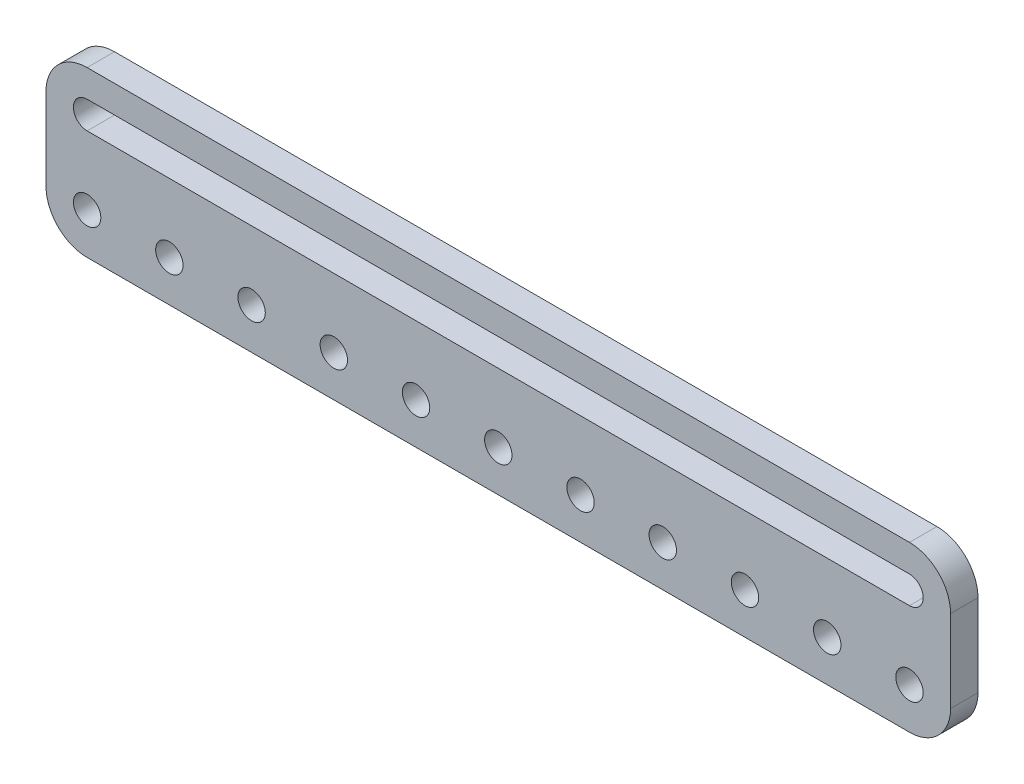
from build123d import *

# Parameters (mm, degrees)
MODEL_R                 = 1.5
SALIENTE_EXTRUIR1_DEPTH = 3


with BuildPart() as part:
    # Model → Saliente-Extruir1 (new body)
    with BuildSketch(Plane.XY):
        with BuildLine():
            Line((256.429131311, 228.742243614), (346.429131311, 228.742243614))
            ThreePointArc((346.429131311, 228.742243614), (349.611111826, 227.424224129), (350.929131311, 224.242243614))
            Line((350.929131311, 224.242243614), (350.929131311, 215.242243614))
            ThreePointArc((350.929131311, 215.242243614), (349.611111826, 212.060263099), (346.429131311, 210.742243614))
            Line((346.429131311, 210.742243614), (256.429131311, 210.742243614))
            ThreePointArc((256.429131311, 210.742243614), (253.247150795, 212.060263099), (251.929131311, 215.242243614))
            Line((251.929131311, 215.242243614), (251.929131311, 224.242243614))
            ThreePointArc((251.929131311, 224.242243614), (253.247150795, 227.424224129), (256.429131311, 228.742243614))
        make_face()
        with Locations((337.429131311, 215.242243614)):
            Circle(MODEL_R, mode=Mode.SUBTRACT)
        with Locations((319.429131311, 215.242243614)):
            Circle(MODEL_R, mode=Mode.SUBTRACT)
        with Locations((328.429131311, 215.242243614)):
            Circle(MODEL_R, mode=Mode.SUBTRACT)
        with Locations((310.429131311, 215.242243614)):
            Circle(MODEL_R, mode=Mode.SUBTRACT)
        with Locations((292.429131311, 215.242243614)):
            Circle(MODEL_R, mode=Mode.SUBTRACT)
        with Locations((301.429131311, 215.242243614)):
            Circle(MODEL_R, mode=Mode.SUBTRACT)
        with Locations((274.429131311, 215.242243614)):
            Circle(MODEL_R, mode=Mode.SUBTRACT)
        with Locations((283.429131311, 215.242243614)):
            Circle(MODEL_R, mode=Mode.SUBTRACT)
        with Locations((265.429131311, 215.242243614)):
            Circle(MODEL_R, mode=Mode.SUBTRACT)
        with Locations((256.429131311, 215.242243614)):
            Circle(MODEL_R, mode=Mode.SUBTRACT)
        with Locations((346.429131311, 215.242243614)):
            Circle(MODEL_R, mode=Mode.SUBTRACT)
        with BuildLine():
            Line((256.429131311, 225.742243614), (346.429131311, 225.742243614))
            ThreePointArc((346.429131311, 225.742243614), (347.929131311, 224.242243614), (346.429131311, 222.742243614))
            Line((346.429131311, 222.742243614), (256.429131311, 222.742243614))
            ThreePointArc((256.429131311, 222.742243614), (254.929131311, 224.242243614), (256.429131311, 225.742243614))
        make_face(mode=Mode.SUBTRACT)
    extrude(amount=SALIENTE_EXTRUIR1_DEPTH)


solid = part.part
